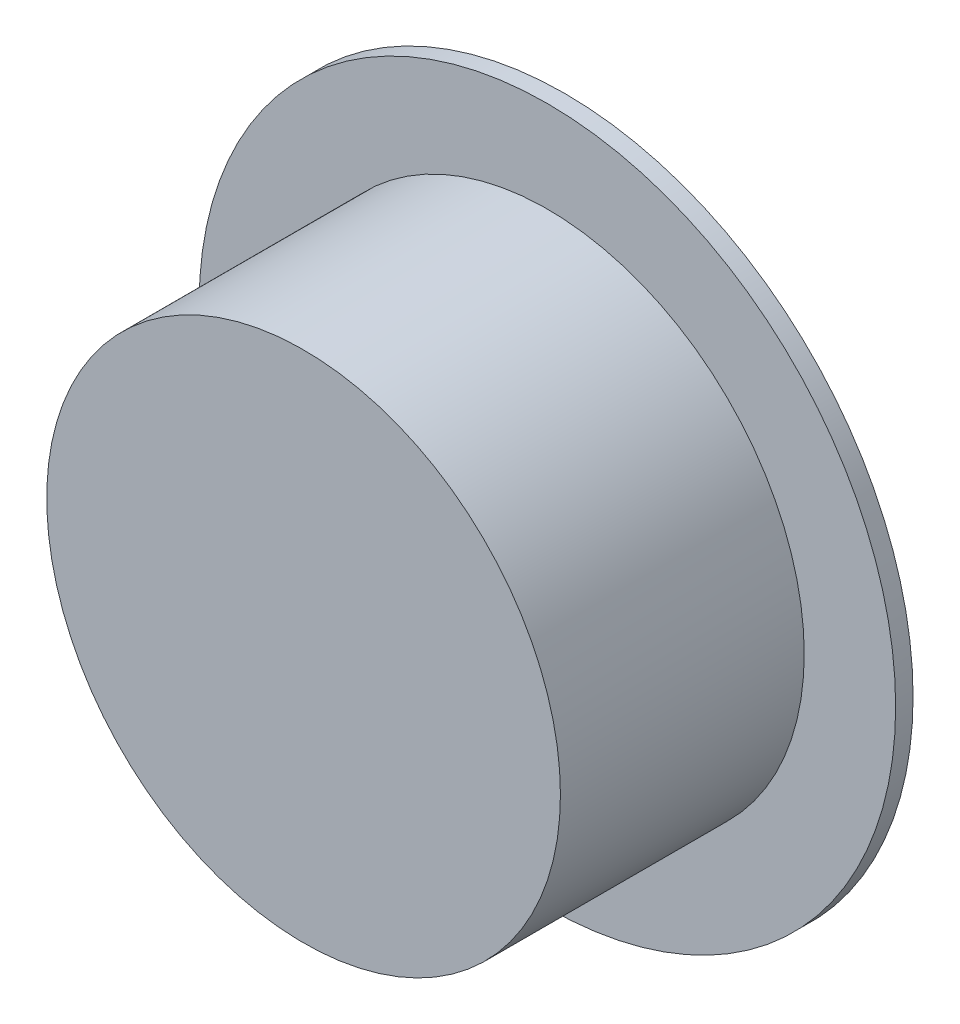
from build123d import *

# Parameters (mm, degrees)
SKETCH2_R           = 14.75
BOSS_EXTRUDE1_DEPTH = 7.5
BOSS_EXTRUDE2_START = -7.5
SKETCH3_R           = 20
BOSS_EXTRUDE2_DEPTH = 1
SKETCH4_R           = 12.5
CUT_EXTRUDE1_DEPTH  = 10


with BuildPart() as part:
    # Sketch2 → Boss-Extrude1 (new, symmetric)
    with BuildSketch(Plane.XY):
        Circle(SKETCH2_R)
    extrude(amount=BOSS_EXTRUDE1_DEPTH, both=True)

    # Sketch3 → Boss-Extrude2 (add)
    with BuildSketch(Plane.XY.offset(BOSS_EXTRUDE2_START)):
        Circle(SKETCH3_R)
    extrude(amount=BOSS_EXTRUDE2_DEPTH)

    # Sketch4 → Cut-Extrude1 (cut)
    with BuildSketch(Plane(origin=(0, 0, -7.5), x_dir=(-1, 0, 0), z_dir=(0, 0, -1))):
        Circle(SKETCH4_R)
    extrude(amount=-CUT_EXTRUDE1_DEPTH, mode=Mode.SUBTRACT)


solid = part.part
